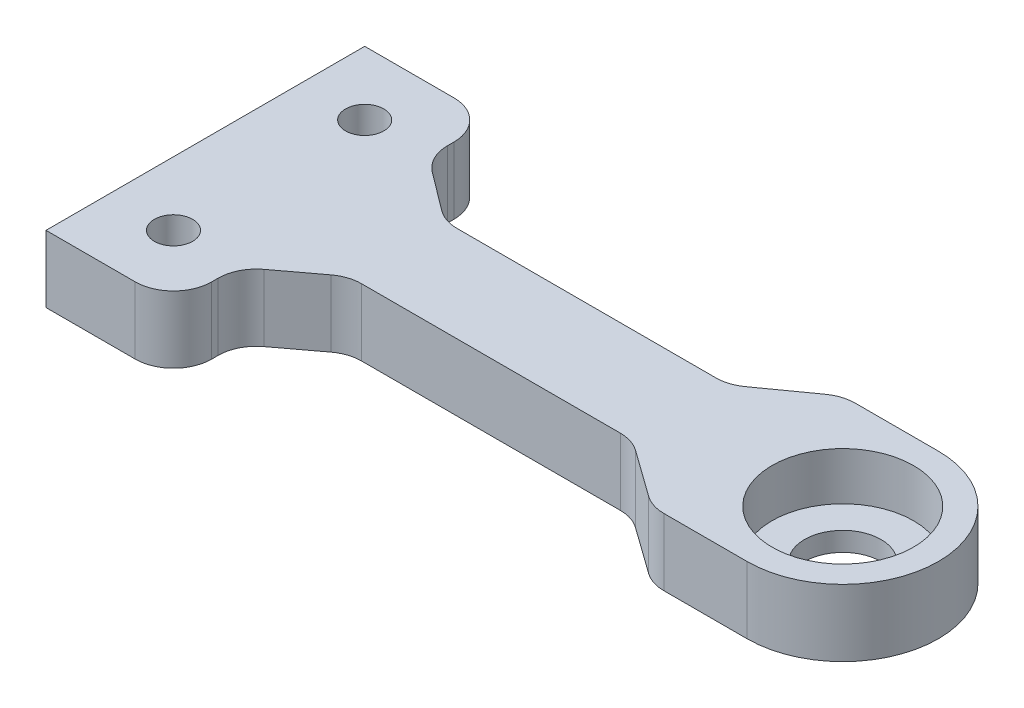
from build123d import *

# Parameters (mm, degrees)
SKETCH1_W           = 115
SKETCH1_H           = 30
BOSS_EXTRUDE1_DEPTH = 10.5
CUT_EXTRUDE1_START  = 3
SKETCH2_R           = 11.1
CUT_EXTRUDE1_DEPTH  = 10.5
SKETCH3_R           = 6
CUT_EXTRUDE4_DEPTH  = 10.5
BOSS_EXTRUDE2_DEPTH = 10.5
SKETCH6_R           = 2.25
CUT_EXTRUDE5_DEPTH  = 10.5
SKETCH7_R           = 3
CUT_EXTRUDE6_DEPTH  = 7.5
CUT_EXTRUDE7_DEPTH  = 28.5
FILLET1_R           = 6
FILLET2_RADIUS      = 15
FILLET2_LENGTH      = 10.5


with BuildPart() as part:
    # Sketch1 → Boss-Extrude1 (new body)
    with BuildSketch(Plane(origin=(0, 0, 0), x_dir=(1, 0, 0), z_dir=(0, 1, 0))):
        Rectangle(SKETCH1_W, SKETCH1_H)
    extrude(amount=BOSS_EXTRUDE1_DEPTH)

    # Sketch2 → Cut-Extrude1 (cut)
    with BuildSketch(Plane(origin=(0, 0, 0), x_dir=(1, 0, 0), z_dir=(0, 1, 0)).offset(CUT_EXTRUDE1_START)):
        with Locations(Location((42.5, 0, 0), (0, 0, 90))):
            Circle(SKETCH2_R)
    extrude(amount=CUT_EXTRUDE1_DEPTH, mode=Mode.SUBTRACT)

    # Sketch3 → Cut-Extrude4 (cut)
    with BuildSketch(Plane(origin=(0, 0, 0), x_dir=(1, 0, 0), z_dir=(0, 1, 0))):
        with Locations(Location((42.5, 0, 0), (0, 0, 90))):
            Circle(SKETCH3_R)
    extrude(amount=CUT_EXTRUDE4_DEPTH, mode=Mode.SUBTRACT)

    # Sketch5 → Boss-Extrude2 (add)
    with BuildSketch(Plane(origin=(0, 0, 0), x_dir=(1, 0, 0), z_dir=(0, 1, 0))):
        Polygon((-57.5, 15), (-57.5, 25), (-37.5, 25), (-37.5, -25), (-57.5, -25), (-57.5, -15), align=None)
    extrude(amount=BOSS_EXTRUDE2_DEPTH)

    # Sketch6 → Cut-Extrude5 (cut)
    with BuildSketch(Plane(origin=(0, 10.5, 0), x_dir=(1, 0, 0), z_dir=(0, 1, 0))):
        with Locations(Location((-47.5, -15, 0), (0, 0, 270))):
            Circle(SKETCH6_R)
        with Locations(Location((-47.5, 15, 0), (0, 0, 270))):
            Circle(SKETCH6_R)
    extrude(amount=-CUT_EXTRUDE5_DEPTH, mode=Mode.SUBTRACT)

    # Sketch7 → Cut-Extrude6 (cut)
    with BuildSketch(Plane(origin=(0, 10.5, 0), x_dir=(1, 0, 0), z_dir=(0, 1, 0))):
        with Locations(Location((-47.5, 15, 0), (0, 0, 270))):
            Circle(SKETCH7_R)
        with Locations(Location((-47.5, -15, 0), (0, 0, 270))):
            Circle(SKETCH7_R)
    extrude(amount=-CUT_EXTRUDE6_DEPTH, mode=Mode.SUBTRACT)

    # Sketch8 → Cut-Extrude7 (cut)
    with BuildSketch(Plane(origin=(0, 10.5, 0), x_dir=(1, 0, 0), z_dir=(0, 1, 0))):
        Polygon((-37.5, 15), (-27.5, 7.5), (17.022877386, 7.5), (27.5, 15), align=None)
        Polygon((-37.5, -15), (27.5, -15), (17.022877386, -7.5), (-27.5, -7.5), align=None)
    extrude(amount=-CUT_EXTRUDE7_DEPTH, mode=Mode.SUBTRACT)

    # Fillet1
    fillet1_edges = [part.edges().sort_by_distance(p)[0] for p in [
        (-37.5, 5.25, -15),
        (-37.5, 5.25, 15),
        (-37.5, 5.25, 25),
        (-37.5, 5.25, -25),
        (27.5, 5.25, -15),
        (17.022877386, 5.25, -7.5),
        (-27.5, 5.25, -7.5),
        (-27.5, 5.25, 7.5),
        (17.022877386, 5.25, 7.5),
        (27.5, 5.25, 15),
    ]]
    fillet(fillet1_edges, radius=FILLET1_R)

    # Fillet2: full round fillet: the end face becomes a half cylinder, R = half its width
    fillet2_face = Plane((57.5, 5.25, 0), x_dir=(0, -1, 0), z_dir=(1, 0, 0))  # on the end face: x along it, z out of the body
    fillet2_slab = fillet2_face.offset(-FILLET2_RADIUS / 2) * Box(FILLET2_LENGTH, 2 * FILLET2_RADIUS, FILLET2_RADIUS, mode=Mode.PRIVATE)  # the body's end, R deep
    fillet2_round = Plane((42.5, 5.25, 0), x_dir=(1, 0, 0), z_dir=(0, -1, 0)) * Cylinder(FILLET2_RADIUS, FILLET2_LENGTH, mode=Mode.PRIVATE)  # its axis R under the face
    add(fillet2_slab - fillet2_round, mode=Mode.SUBTRACT)


solid = part.part
